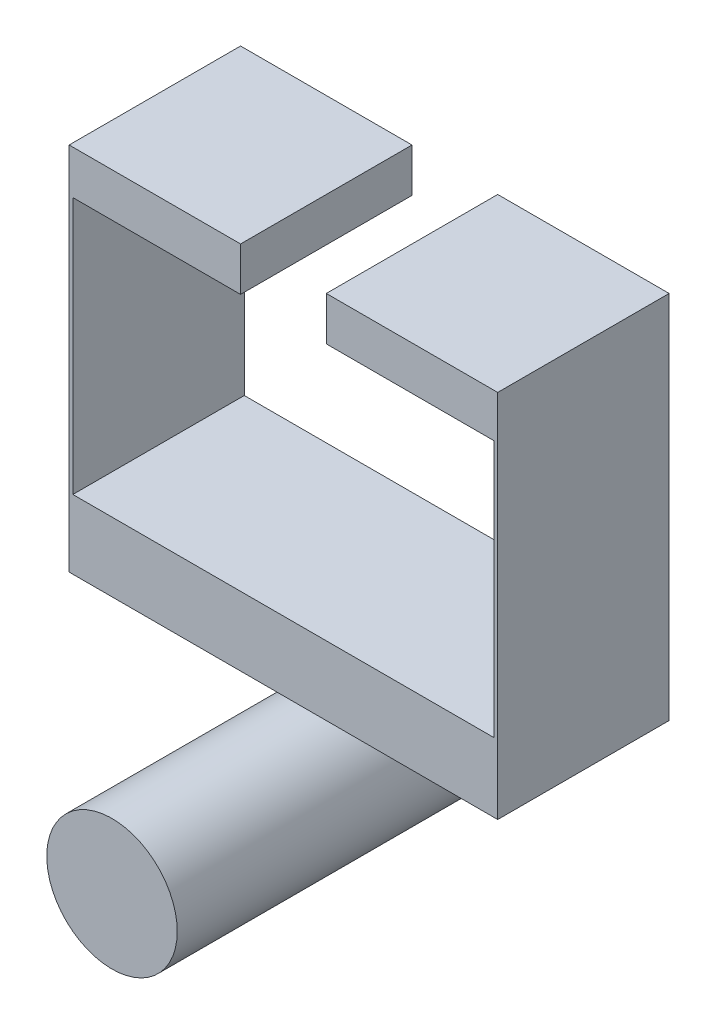
from build123d import *

# Parameters (mm, degrees)
SKETCH1_R           = 9.667215137
BOSS_EXTRUDE1_DEPTH = 50.8
SKETCH2_W           = 19.334430274
SKETCH2_H           = 12.7
BOSS_EXTRUDE2_DEPTH = 8.89
BOSS_EXTRUDE3_DEPTH = 25.4
SKETCH5_W           = 0.549916313
SKETCH5_H           = 38.1
BOSS_EXTRUDE4_DEPTH = 25.4
SKETCH6_W           = 25.4
SKETCH6_H           = 6.473300788
BOSS_EXTRUDE5_DEPTH = 25.4


with BuildPart() as part:
    # Sketch1 → Boss-Extrude1 (new body)
    with BuildSketch(Plane.XY):
        Circle(SKETCH1_R)
    extrude(amount=BOSS_EXTRUDE1_DEPTH)

    # Sketch2 → Boss-Extrude2 (add)
    with BuildSketch(Plane(origin=(0, 0, 0), x_dir=(-1, 0, 0), z_dir=(0, 0, -1))):
        with Locations((0, 6.35)):
            Rectangle(SKETCH2_W, SKETCH2_H)
    extrude(amount=-BOSS_EXTRUDE2_DEPTH)

    # Sketch4 → Boss-Extrude3 (add)
    with BuildSketch(Plane(origin=(0, 0, 0), x_dir=(-1, 0, 0), z_dir=(0, 0, -1))):
        Polygon((-31.75, 12.7), (-31.75, 22.935187234), (31.75, 22.935187234), (31.75, 12.7), (9.667215137, 12.7), (-9.667215137, 12.7), align=None)
    extrude(amount=-BOSS_EXTRUDE3_DEPTH)

    # Sketch5 → Boss-Extrude4 (add)
    with BuildSketch(Plane(origin=(0, 0, 0), x_dir=(-1, 0, 0), z_dir=(0, 0, -1))):
        with Locations((31.475041844, 41.985187234)):
            Rectangle(SKETCH5_W, SKETCH5_H)
        with Locations((-31.475041844, 41.985187234)):
            Rectangle(SKETCH5_W, SKETCH5_H)
    extrude(amount=-BOSS_EXTRUDE4_DEPTH)

    # Sketch6 → Boss-Extrude5 (add)
    with BuildSketch(Plane(origin=(0, 0, 0), x_dir=(-1, 0, 0), z_dir=(0, 0, -1))):
        with Locations((19.05, 64.271837628)):
            Rectangle(SKETCH6_W, SKETCH6_H)
        with Locations((-19.05, 64.271837628)):
            Rectangle(SKETCH6_W, SKETCH6_H)
    extrude(amount=-BOSS_EXTRUDE5_DEPTH)


solid = part.part
